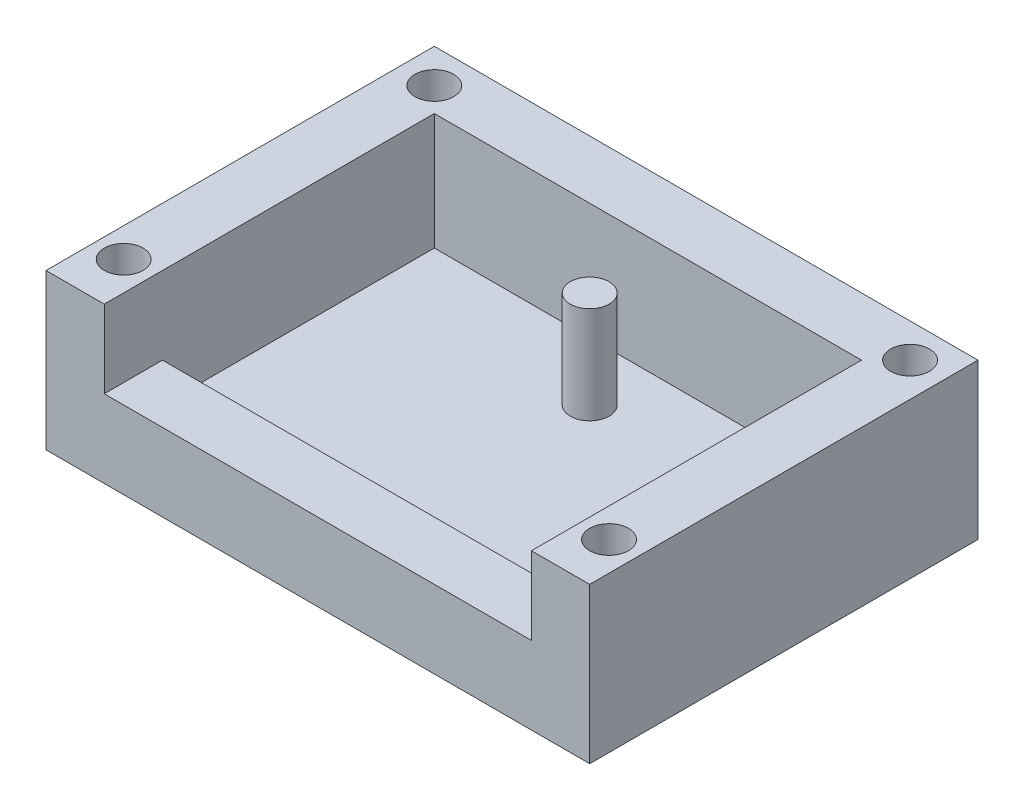
from build123d import *

# Parameters (mm, degrees)
ESQUISSE3_W             = 28
ESQUISSE3_H             = 20
BOSS_EXTRU_1_DEPTH      = 8
ESQUISSE4_W             = 22
ESQUISSE4_H             = 14
ENL_V_MAT_EXTRU_1_DEPTH = 6
ESQUISSE5_W             = 22
ESQUISSE5_H             = 3
ENL_V_MAT_EXTRU_2_DEPTH = 4
ESQUISSE7_R             = 1
BOSS_EXTRU_2_DEPTH      = 5
ESQUISSE9_R             = 1
ENL_V_MAT_EXTRU_3_DEPTH = 2
ESQUISSE11_R            = 1
ENL_V_MAT_EXTRU_4_DEPTH = 2


with BuildPart() as part:
    # Esquisse3 → Boss.-Extru.1 (new body)
    with BuildSketch(Plane(origin=(0, 0, 0), x_dir=(1, 0, 0), z_dir=(0, 1, 0))):
        with Locations((-14, -10)):
            Rectangle(ESQUISSE3_W, ESQUISSE3_H)
    extrude(amount=BOSS_EXTRU_1_DEPTH)

    # Esquisse4 → Enlèv. mat.-Extru.1 (cut)
    with BuildSketch(Plane(origin=(0, 8, 0), x_dir=(1, 0, 0), z_dir=(0, 1, 0))):
        with Locations((-14, -10)):
            Rectangle(ESQUISSE4_W, ESQUISSE4_H)
    extrude(amount=-ENL_V_MAT_EXTRU_1_DEPTH, mode=Mode.SUBTRACT)

    # Esquisse5 → Enlèv. mat.-Extru.2 (cut)
    with BuildSketch(Plane(origin=(0, 8, 0), x_dir=(1, 0, 0), z_dir=(0, 1, 0))):
        with Locations((-14, -18.5)):
            Rectangle(ESQUISSE5_W, ESQUISSE5_H)
    extrude(amount=-ENL_V_MAT_EXTRU_2_DEPTH, mode=Mode.SUBTRACT)

    # Esquisse7 → Boss.-Extru.2 (add)
    with BuildSketch(Plane(origin=(0, 2, 0), x_dir=(1, 0, 0), z_dir=(0, 1, 0))):
        with Locations(Location((-14, -6, 0), (0, 0, 270))):
            Circle(ESQUISSE7_R)
    extrude(amount=BOSS_EXTRU_2_DEPTH)

    # Esquisse9 → Enlèv. mat.-Extru.3 (cut)
    with BuildSketch(Plane(origin=(0, 8, 0), x_dir=(1, 0, 0), z_dir=(0, 1, 0))):
        with Locations(Location((-26.25, -1.75, 0), (0, 0, 270))):
            Circle(ESQUISSE9_R)
    enl_v_mat_extru_3 = extrude(amount=-ENL_V_MAT_EXTRU_3_DEPTH, mode=Mode.SUBTRACT)

    # Symétrie1: Enlèv. mat.-Extru.3 across plane
    add(enl_v_mat_extru_3.mirror(Plane.ZY.offset(14)), mode=Mode.SUBTRACT)

    # Esquisse11 → Enlèv. mat.-Extru.4 (cut)
    with BuildSketch(Plane(origin=(0, 8, 0), x_dir=(1, 0, 0), z_dir=(0, 1, 0))):
        with Locations(Location((-26.5, -17.5, 0), (0, 0, 270))):
            Circle(ESQUISSE11_R)
    enl_v_mat_extru_4 = extrude(amount=-ENL_V_MAT_EXTRU_4_DEPTH, mode=Mode.SUBTRACT)

    # Symétrie2: Enlèv. mat.-Extru.4 across plane
    add(enl_v_mat_extru_4.mirror(Plane.ZY.offset(14)), mode=Mode.SUBTRACT)


solid = part.part
